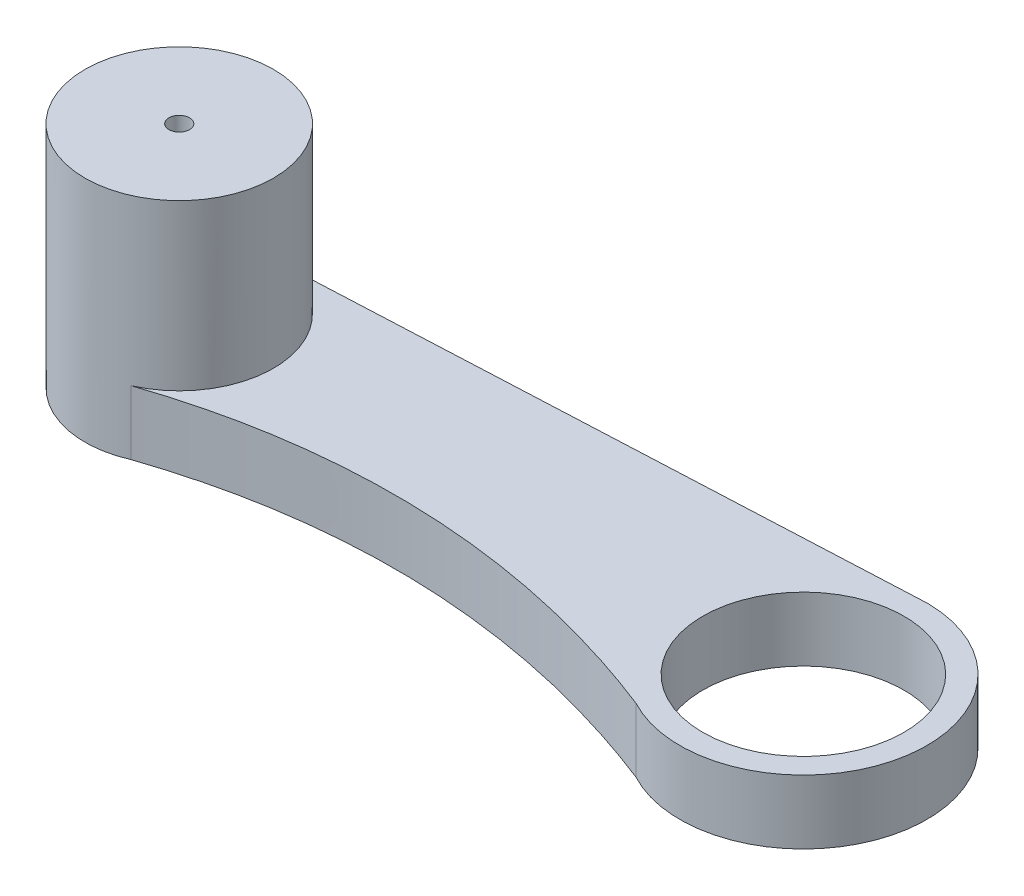
from build123d import *

# Parameters (mm, degrees)
SZKIC1_R                    = 10.3
DODANIE_WYCI_GNI_CIE1_DEPTH = 25
OTWORY_USTALAJ_CE_2_5MM2_D  = 2.25
DODANIE_WYCI_GNI_CIE3_START = -7
DODANIE_WYCI_GNI_CIE3_DEPTH = 7
OTWORY_USTALAJ_CE_2_5MM3_D  = 22


with BuildPart() as part:
    # Szkic1 → Dodanie-wyciągnięcie1 (new body)
    with BuildSketch(Plane(origin=(0, 0, 0), x_dir=(1, 0, 0), z_dir=(0, 1, 0))):
        with Locations(Location((0, 0, 0), (0, 0, 270))):
            Circle(SZKIC1_R)
    extrude(amount=DODANIE_WYCI_GNI_CIE1_DEPTH)

    # Otwory ustalające Ø2.5mm2 (through all)
    with Locations(Plane.XZ):
        with Locations((0, 0)):
            Hole(OTWORY_USTALAJ_CE_2_5MM2_D / 2)

    # Szkic7 → Dodanie-wyciągnięcie3 (add)
    with BuildSketch(Plane(origin=(0, 25, 0), x_dir=(1, 0, 0), z_dir=(0, 1, 0)).offset(DODANIE_WYCI_GNI_CIE3_START)):
        with BuildLine():
            Line((66.943357066, 13.440701035), (0, 10.3))
            ThreePointArc((0, 10.3), (10.077130906, 2.131063748), (4.169904535, -9.418168408))
            add(Edge.make_bspline(
                [(4.169904535, -9.418168408), (22.461776037, -3.24596138), (41.934151815, -4.077243057), (61.820006497, -11.893378905)],
                knots=[0, 0, 0, 0, 1, 1, 1, 1], degree=3))
            ThreePointArc((61.820006497, -11.893378905), (81.439431711, -2.675954354), (66.943357066, 13.440701035))
        make_face()
    extrude(amount=DODANIE_WYCI_GNI_CIE3_DEPTH)

    # Otwory ustalające Ø2.5mm3 (through all)
    with Locations(Plane(origin=(0, 25, 0), x_dir=(1, 0, 0), z_dir=(0, 1, 0))):
        with Locations((68.207301561, 0)):
            Hole(OTWORY_USTALAJ_CE_2_5MM3_D / 2)


with BuildPart() as body_2:
    # Lustro1: mirrored copy
    add(part.part.mirror(Plane.ZX))


solid = body_2.part
